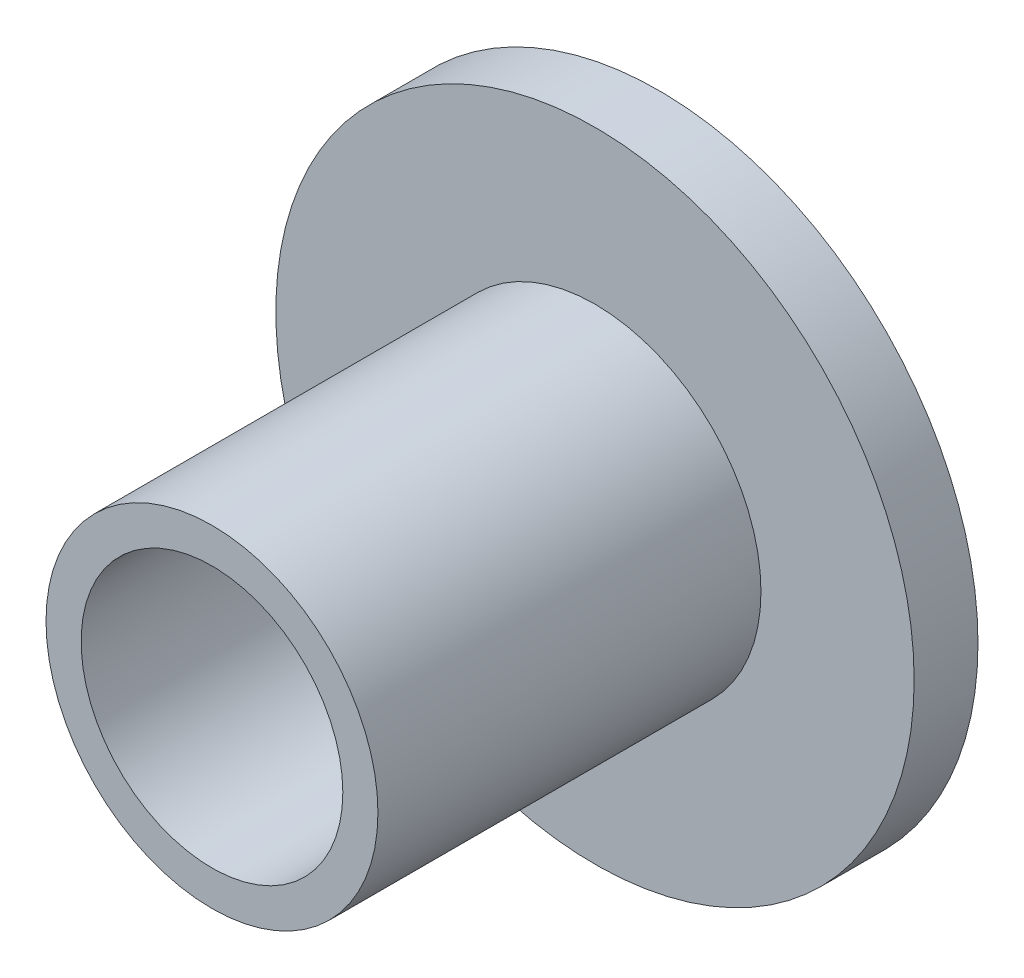
from build123d import *

# Parameters (mm, degrees)
ESQUISSE1_R        = 25
BOSS_EXTRU_1_DEPTH = 5
ESQUISSE2_R        = 13
ESQUISSE2_R_2      = 10.25
BOSS_EXTRU_2_DEPTH = 30


with BuildPart() as part:
    # Esquisse1 → Boss.-Extru.1 (new body)
    with BuildSketch(Plane.XY):
        Circle(ESQUISSE1_R)
    extrude(amount=BOSS_EXTRU_1_DEPTH)

    # Esquisse2 → Boss.-Extru.2 (add)
    with BuildSketch(Plane.XY.offset(5)):
        Circle(ESQUISSE2_R)
        Circle(ESQUISSE2_R_2, mode=Mode.SUBTRACT)
    extrude(amount=BOSS_EXTRU_2_DEPTH)


solid = part.part
